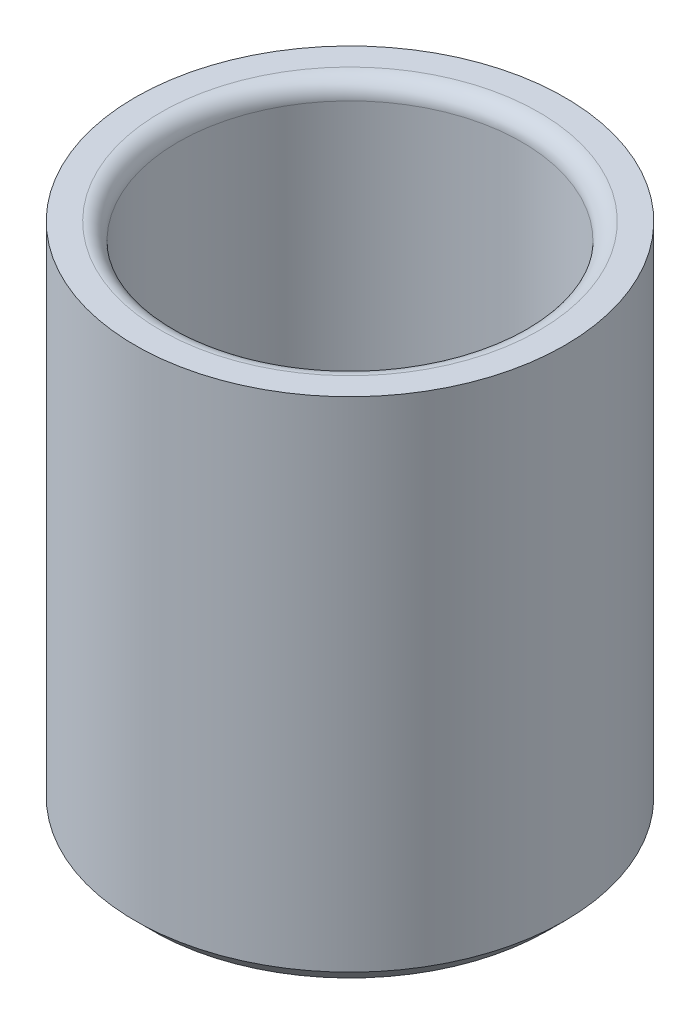
from build123d import *

# Parameters (mm, degrees)
BODY_SECTION_W      = 1.5875
BODY_SECTION_H      = 19.05
TOP_RADIUS_R        = 0.635
BOTTOM_CHAMFER_SIZE = 0.635


with BuildPart() as part:
    # BODY SECTION → BODY (revolve)
    with BuildSketch(Plane.XY, mode=Mode.PRIVATE) as body_sk:
        with Locations((7.14375, -9.525)):
            Rectangle(BODY_SECTION_W, BODY_SECTION_H)
    revolve(body_sk.sketch.rotate(Axis((0, 0, 0), (0, -1, 0)), 180), axis=Axis((0, 0, 0), (0, -1, 0)))

    # TOP RADIUS
    top_radius_edges = [part.edges().sort_by_distance(p)[0] for p in [
        (6.35, 0, 0),
    ]]
    fillet(top_radius_edges, radius=TOP_RADIUS_R)

    # BOTTOM CHAMFER
    bottom_chamfer_edges = [part.edges().sort_by_distance(p)[0] for p in [
        (7.9375, -19.05, 0),
    ]]
    chamfer(bottom_chamfer_edges, length=BOTTOM_CHAMFER_SIZE)


solid = part.part
